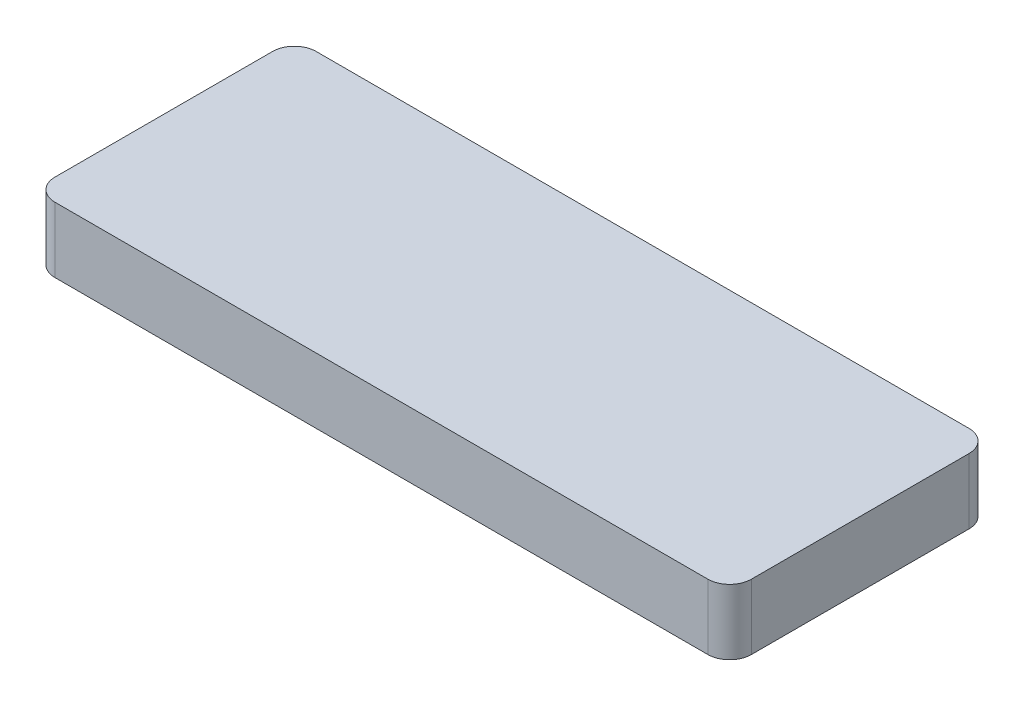
from build123d import *

# Parameters (mm, degrees)
BOSS_EXTRUDE1_DEPTH = 19.05


with BuildPart() as part:
    # Sketch1 → Boss-Extrude1 (new body)
    with BuildSketch(Plane(origin=(0, 0, 0), x_dir=(1, 0, 0), z_dir=(0, 1, 0))):
        with BuildLine():
            Line((-95.25, -38.1), (95.25, -38.1))
            ThreePointArc((95.25, -38.1), (99.740128061, -36.240128061), (101.6, -31.75))
            Line((101.6, -31.75), (101.6, 31.75))
            ThreePointArc((101.6, 31.75), (99.740128061, 36.240128061), (95.25, 38.1))
            Line((95.25, 38.1), (-95.25, 38.1))
            ThreePointArc((-95.25, 38.1), (-99.740128061, 36.240128061), (-101.6, 31.75))
            Line((-101.6, 31.75), (-101.6, -31.75))
            ThreePointArc((-101.6, -31.75), (-99.740128061, -36.240128061), (-95.25, -38.1))
        make_face()
    extrude(amount=BOSS_EXTRUDE1_DEPTH)


solid = part.part
